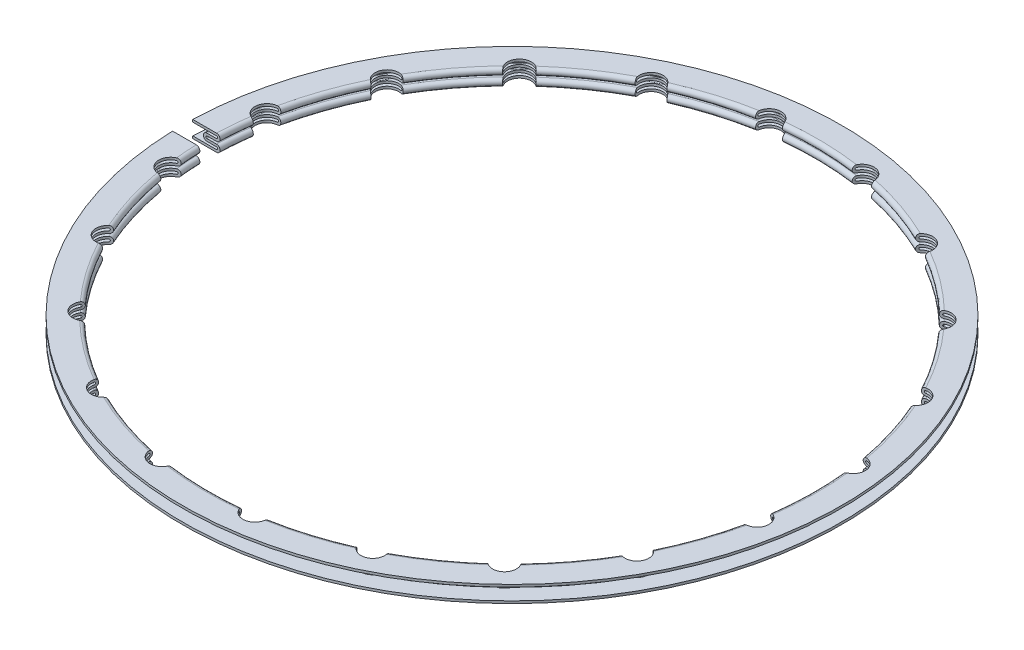
from build123d import *

# Parameters (mm, degrees)
SKETCH2_R          = 1.27
CUT_EXTRUDE1_DEPTH = 50.872125446
CIRPATTERN1_COUNT  = 20
SKETCH3_W          = 2.939032044
SKETCH3_H          = 2.159
CUT_EXTRUDE2_DEPTH = 50.87212545


with BuildPart() as part:
    # Sketch1 → Revolve-Thin1 (revolve)
    with BuildSketch(Plane.XY, mode=Mode.PRIVATE) as revolve_thin1_sk:
        with BuildLine():
            Line((35.2425, 0.127), (32.7025, 0.127))
            ThreePointArc((32.7025, 0.127), (32.5755, 0.254), (32.7025, 0.381))
            Line((32.7025, 0.381), (33.7185, 0.381))
            ThreePointArc((33.7185, 0.381), (34.0995, 0.762), (33.7185, 1.143))
            Line((33.7185, 1.143), (32.7025, 1.143))
            ThreePointArc((32.7025, 1.143), (32.5755, 1.27), (32.7025, 1.397))
            Line((32.7025, 1.397), (35.2425, 1.397))
            Line((35.2425, 1.397), (35.2425, 1.651))
            Line((35.2425, 1.651), (32.7025, 1.651))
            ThreePointArc((32.7025, 1.651), (32.3215, 1.27), (32.7025, 0.889))
            Line((32.7025, 0.889), (33.7185, 0.889))
            ThreePointArc((33.7185, 0.889), (33.8455, 0.762), (33.7185, 0.635))
            Line((33.7185, 0.635), (32.7025, 0.635))
            ThreePointArc((32.7025, 0.635), (32.3215, 0.254), (32.7025, -0.127))
            Line((32.7025, -0.127), (35.2425, -0.127))
            Line((35.2425, -0.127), (35.2425, 0.127))
        make_face()
    revolve(revolve_thin1_sk.sketch.rotate(Axis((0, 0, 0), (0, 1, 0)), 90), axis=Axis((0, 0, 0), (0, 1, 0)))

    # Sketch2 → Cut-Extrude1 (cut, through all)
    with BuildSketch(Plane(origin=(0, 1.651, 0), x_dir=(1, 0, 0), z_dir=(0, 1, 0))):
        with Locations((5.612569574, 31.830463789)):
            Circle(SKETCH2_R)
    cut_extrude1 = extrude(amount=-CUT_EXTRUDE1_DEPTH, mode=Mode.SUBTRACT)

    # CirPattern1: Cut-Extrude1 ×20 about axis
    cirpattern1_axis = Axis((0, 0, 0), (0, 1, 0))
    for i in range(1, CIRPATTERN1_COUNT):
        add(cut_extrude1.rotate(cirpattern1_axis, i * 360 / CIRPATTERN1_COUNT), mode=Mode.SUBTRACT)

    # Sketch3 → Cut-Extrude2 (cut, through all)
    with BuildSketch(Plane(origin=(0, 1.651, 0), x_dir=(1, 0, 0), z_dir=(0, 1, 0))):
        with Locations((-33.772983978, 0)):
            Rectangle(SKETCH3_W, SKETCH3_H)
    extrude(amount=-CUT_EXTRUDE2_DEPTH, mode=Mode.SUBTRACT)


solid = part.part
